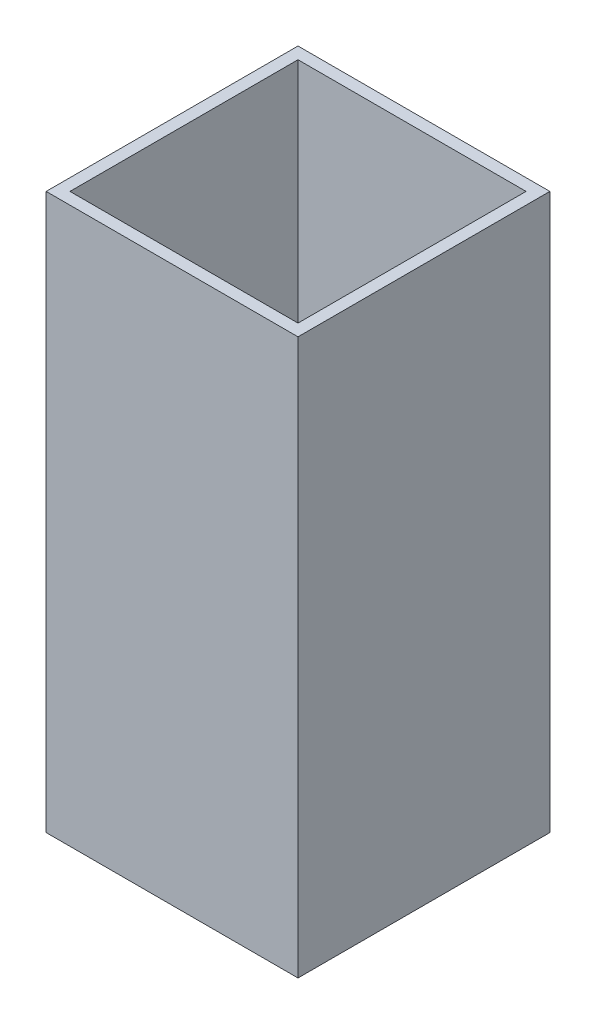
from build123d import *

# Parameters (mm, degrees)
SKETCH1_W           = 25.4
SKETCH1_H           = 25.4
SKETCH1_W_2         = 23
SKETCH1_H_2         = 23
BOSS_EXTRUDE1_DEPTH = 56


with BuildPart() as part:
    # Sketch1 → Boss-Extrude1 (new body)
    with BuildSketch(Plane(origin=(0, 0, 0), x_dir=(1, 0, 0), z_dir=(0, 1, 0))):
        Rectangle(SKETCH1_W, SKETCH1_H)
        Rectangle(SKETCH1_W_2, SKETCH1_H_2, mode=Mode.SUBTRACT)
    extrude(amount=BOSS_EXTRUDE1_DEPTH)


solid = part.part
